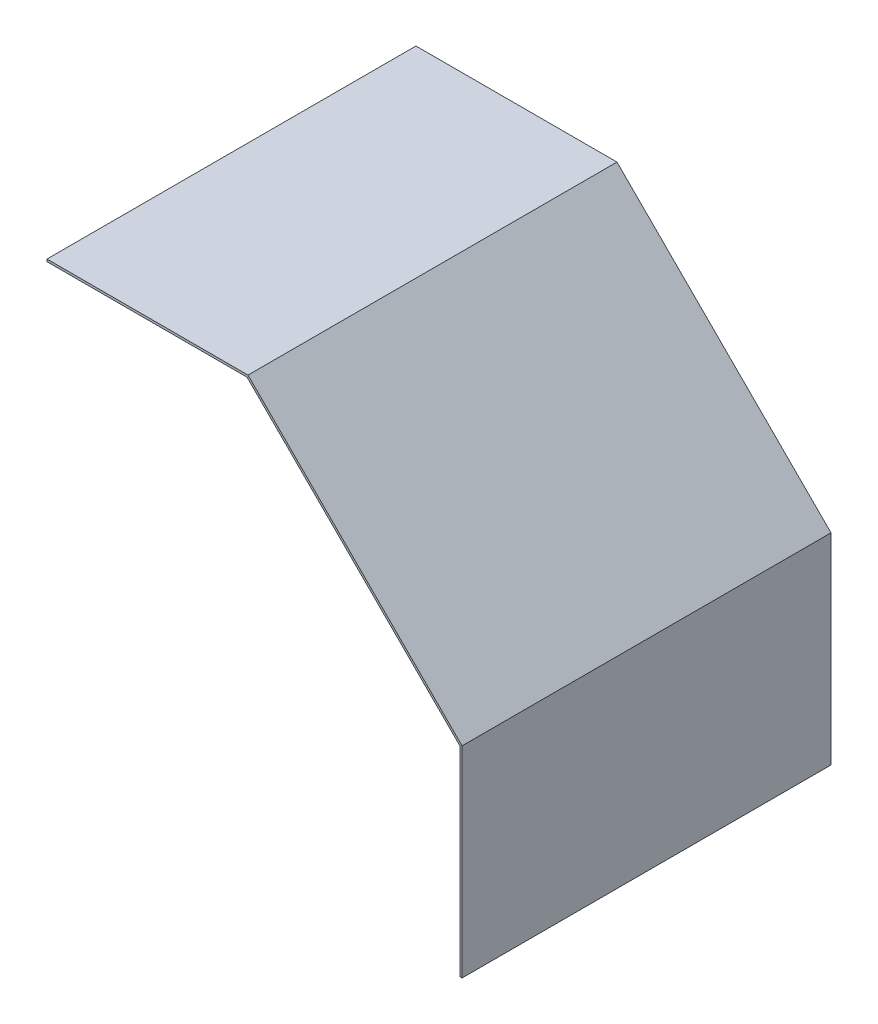
from build123d import *

# Parameters (mm, degrees)
EXTRUDE_THIN1_DEPTH = 40


with BuildPart() as part:
    # Sketch1 → Extrude-Thin1 (new body)
    with BuildSketch(Plane.XY):
        Polygon((0, 45), (21.794494718, 45), (45, 21.794494718), (45, 0), (44.75, 0), (44.75, 21.690941327), (21.690941327, 44.75), (0, 44.75), align=None)
    extrude(amount=EXTRUDE_THIN1_DEPTH)


solid = part.part
